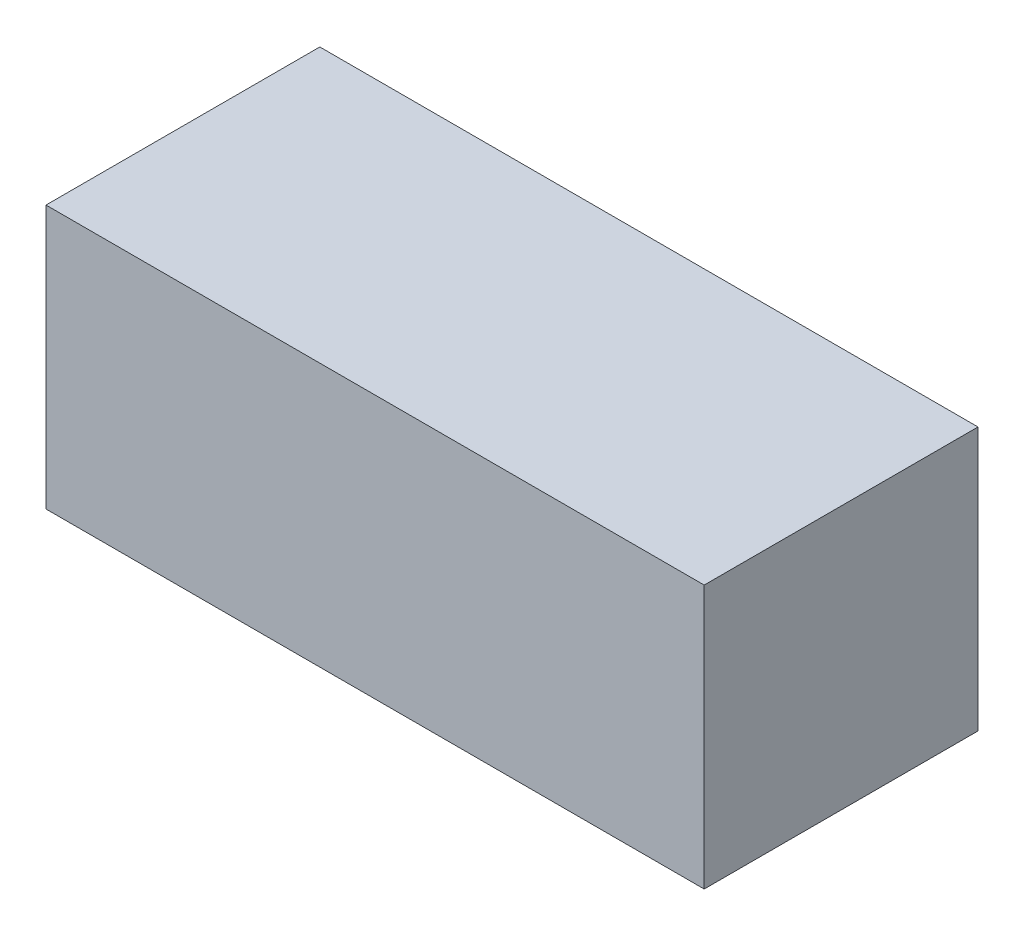
from build123d import *

# Parameters (mm, degrees)
AUFSATZ_LINEAR_AUSTRAGEN1_DEPTH = 400
SKIZZE2_W                       = 1000
SKIZZE2_H                       = 400
AUFSATZ_LINEAR_AUSTRAGEN2_DEPTH = 16


with BuildPart() as part:
    # Skizze1 → Aufsatz-Linear austragen1 (new body)
    with BuildSketch(Plane.XY):
        Polygon((0, 0), (0, 400), (1000, 400), (1000, 0), (984, 0), (984, 384), (16, 384), (16, 0), align=None)
    extrude(amount=-AUFSATZ_LINEAR_AUSTRAGEN1_DEPTH)

    # Skizze2 → Aufsatz-Linear austragen2 (add)
    with BuildSketch(Plane.XY):
        with Locations((500, 200)):
            Rectangle(SKIZZE2_W, SKIZZE2_H)
    extrude(amount=AUFSATZ_LINEAR_AUSTRAGEN2_DEPTH)


solid = part.part
